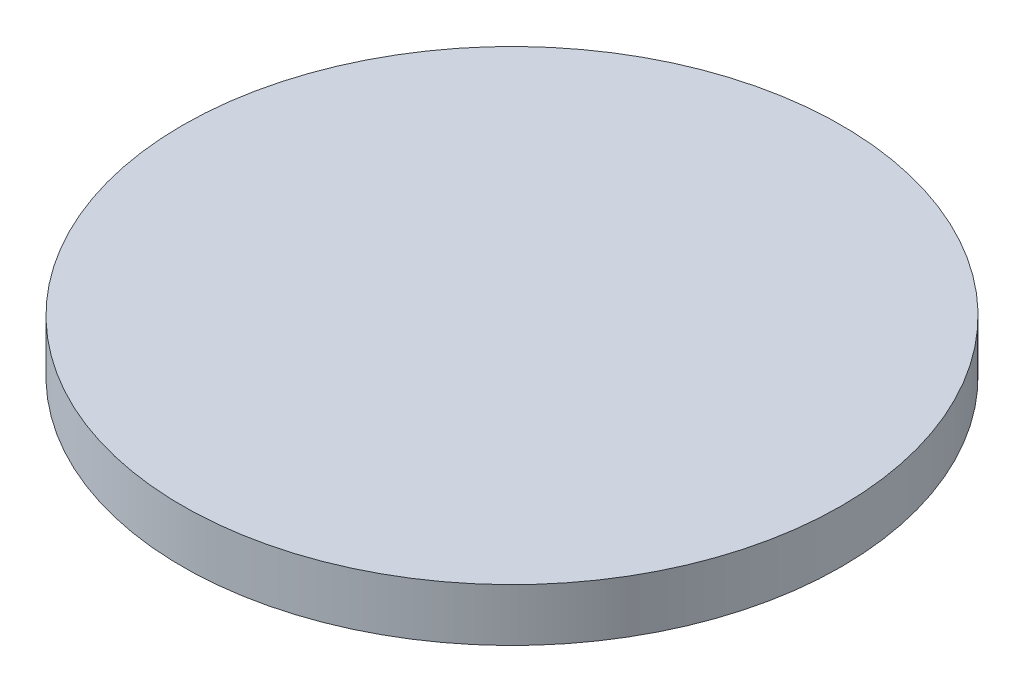
from build123d import *

# Parameters (mm, degrees)
SKETCH1_W = 25
SKETCH1_H = 4


with BuildPart() as part:
    # Sketch1 → Revolve1 (revolve)
    with BuildSketch(Plane.XY, mode=Mode.PRIVATE) as revolve1_sk:
        with Locations((-12.5, 2)):
            Rectangle(SKETCH1_W, SKETCH1_H)
    revolve(revolve1_sk.sketch.rotate(Axis((0, 0, 0), (0, 1, 0)), 180), axis=Axis((0, 0, 0), (0, 1, 0)))


solid = part.part
